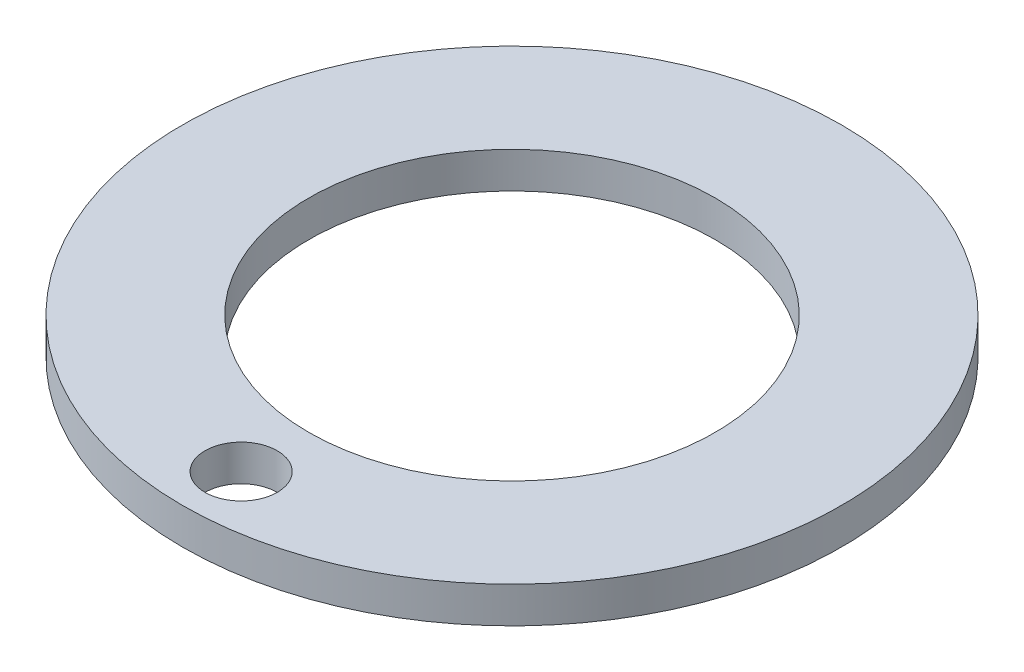
from build123d import *

# Parameters (mm, degrees)
SKETCH1_R           = 18.25
SKETCH1_R_2         = 11.25
SKETCH1_R_3         = 2
BOSS_EXTRUDE1_DEPTH = 2


with BuildPart() as part:
    # Sketch1 → Boss-Extrude1 (new body)
    with BuildSketch(Plane(origin=(0, 0, 0), x_dir=(1, 0, 0), z_dir=(0, 1, 0))):
        with Locations(Location((0, -0.085020243, 0), (0, 0, 270))):
            Circle(SKETCH1_R)
        with Locations(Location((0, -0.085020243, 0), (0, 0, 270))):
            Circle(SKETCH1_R_2, mode=Mode.SUBTRACT)
        with Locations(Location((0, -15.085020243, 0), (0, 0, 270))):
            Circle(SKETCH1_R_3, mode=Mode.SUBTRACT)
    extrude(amount=BOSS_EXTRUDE1_DEPTH)


solid = part.part
